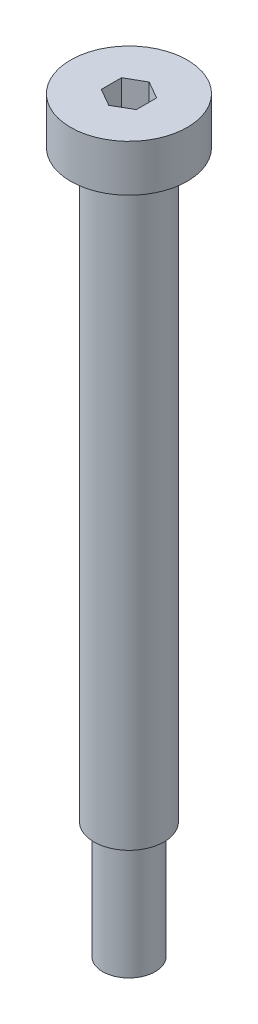
from build123d import *

# Parameters (mm, degrees)
CUT_EXTRUDE1_DEPTH = 3


with BuildPart() as part:
    # Sketch1 → Revolve1 (revolve)
    with BuildSketch(Plane.XY, mode=Mode.PRIVATE) as revolve1_sk:
        Polygon((0, 0), (-5, 0), (-5, -4), (-3, -4), (-3, -54), (-2.25, -54), (-2.25, -64), (0, -64), align=None)
    revolve(revolve1_sk.sketch.rotate(Axis((0, 0, 0), (0, -1, 0)), 270), axis=Axis((0, 0, 0), (0, -1, 0)))

    # Sketch2 → Cut-Extrude1 (cut)
    with BuildSketch(Plane(origin=(0, 0, 0), x_dir=(1, 0, 0), z_dir=(0, 1, 0))):
        Polygon((1.5, 0.866025404), (0, 1.732050808), (-1.5, 0.866025404), (-1.5, -0.866025404), (0, -1.732050808), (1.5, -0.866025404), align=None)
    extrude(amount=-CUT_EXTRUDE1_DEPTH, mode=Mode.SUBTRACT)


solid = part.part
